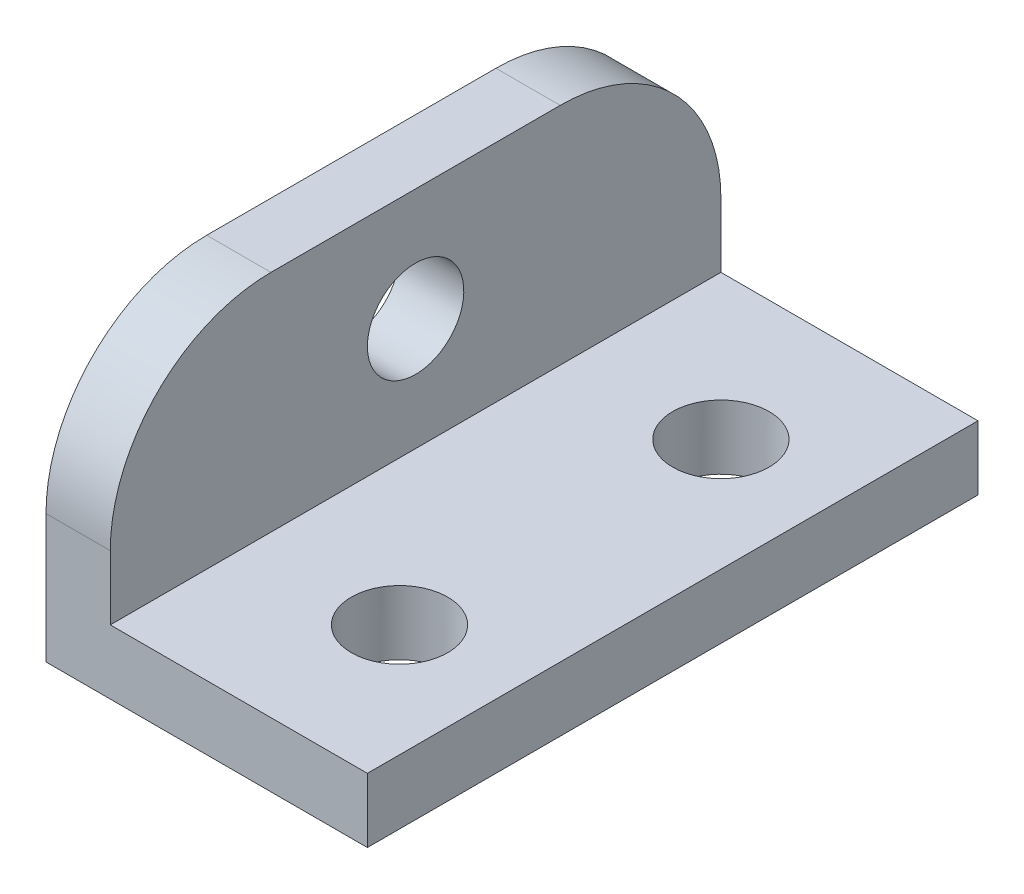
from build123d import *

# Parameters (mm, degrees)
BOSS_EXTRUDE1_DEPTH = 9.5
SKETCH2_R           = 1.5
CUT_EXTRUDE1_DEPTH  = 19
SKETCH3_R           = 1.5
CUT_EXTRUDE2_DEPTH  = 19
FILLET1_R           = 5


with BuildPart() as part:
    # Sketch1 → Boss-Extrude1 (new, symmetric)
    with BuildSketch(Plane.XY):
        Polygon((0, 0), (0, 9), (2, 9), (2, 2), (10, 2), (10, 0), align=None)
    extrude(amount=BOSS_EXTRUDE1_DEPTH, both=True)

    # Sketch2 → Cut-Extrude1 (cut)
    with BuildSketch(Plane(origin=(0, 2, 0), x_dir=(1, 0, 0), z_dir=(0, 1, 0))):
        with Locations(Location((6.5, 5, 0), (0, 0, 270))):
            Circle(SKETCH2_R)
        with Locations(Location((6.5, -5, 0), (0, 0, 270))):
            Circle(SKETCH2_R)
    extrude(amount=-CUT_EXTRUDE1_DEPTH, mode=Mode.SUBTRACT)

    # Sketch3 → Cut-Extrude2 (cut)
    with BuildSketch(Plane(origin=(2, 0, 0), x_dir=(0, 0, -1), z_dir=(1, 0, 0))):
        with Locations(Location((0, 5.5, 0), (0, 0, 90))):
            Circle(SKETCH3_R)
    extrude(amount=-CUT_EXTRUDE2_DEPTH, mode=Mode.SUBTRACT)

    # Fillet1
    fillet1_edges = [part.edges().sort_by_distance(p)[0] for p in [
        (1, 9, 9.5),
        (1, 9, -9.5),
    ]]
    fillet(fillet1_edges, radius=FILLET1_R)


solid = part.part
